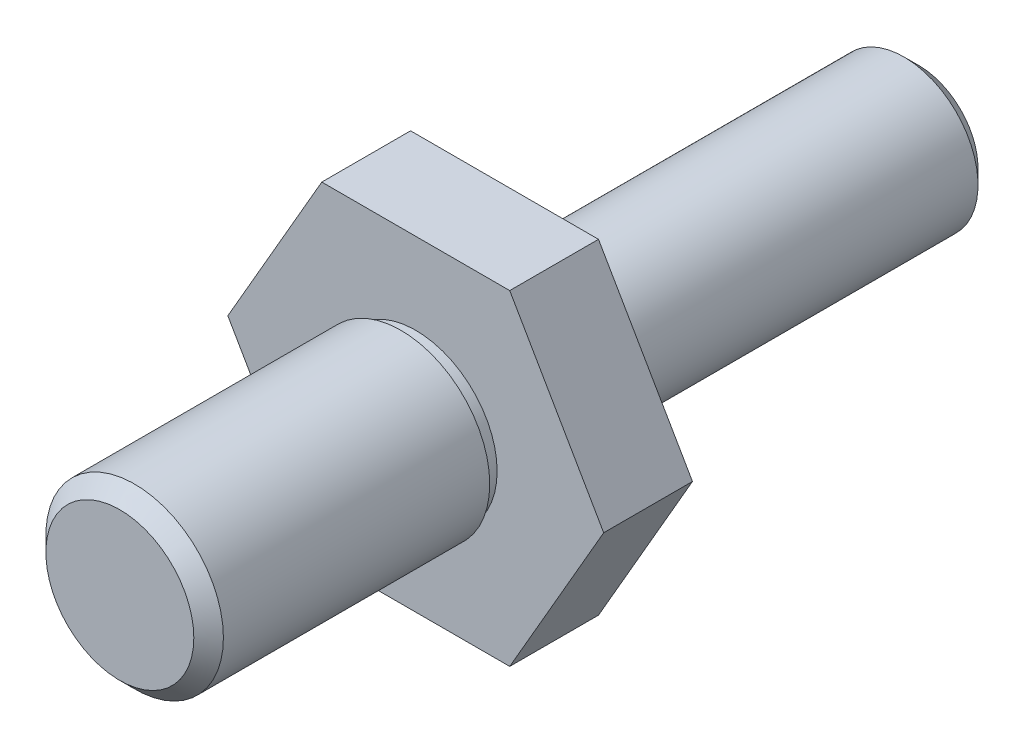
from build123d import *

# Parameters (mm, degrees)
SKETCH_1_R          = 6
EXTRUDE_1_DEPTH     = 20
EXTRUDE_2_DEPTH     = 6
SKETCH_3_R          = 7.5
EXTRUDE_3_DEPTH     = 1.5
SKETCH_4_R          = 5
EXTRUDE_4_DEPTH     = 26.5
SKETCH_6_R          = 6
SKETCH_6_R_2        = 5.5
CUT_EXTRUDE_1_DEPTH = 1
M5X0_8_1_D          = 4.2
M5X0_8_1_DEPTH      = 12.4
M5X0_8_1_TIP        = 1.2618073
CHAMFER_1_SIZE      = 1


with BuildPart() as part:
    # 草图1 → 凸台-拉伸1 (new body)
    with BuildSketch(Plane.XY):
        Circle(SKETCH_1_R)
    extrude(amount=EXTRUDE_1_DEPTH)

    # 草图2 → 凸台-拉伸2 (add)
    with BuildSketch(Plane(origin=(0, 0, 0), x_dir=(-1, 0, 0), z_dir=(0, 0, -1))):
        Polygon((6.350852961, 11), (-6.350852961, 11), (-12.701705922, 0), (-6.350852961, -11), (6.350852961, -11), (12.701705922, 0), align=None)
    extrude(amount=EXTRUDE_2_DEPTH)

    # 草图3 → 凸台-拉伸3 (add)
    with BuildSketch(Plane(origin=(0, 0, -6), x_dir=(-1, 0, 0), z_dir=(0, 0, -1))):
        Circle(SKETCH_3_R)
    extrude(amount=EXTRUDE_3_DEPTH)

    # 草图4 → 凸台-拉伸4 (add)
    with BuildSketch(Plane(origin=(0, 0, -7.5), x_dir=(-1, 0, 0), z_dir=(0, 0, -1))):
        Circle(SKETCH_4_R)
    extrude(amount=EXTRUDE_4_DEPTH)

    # 草图6 → 切除-拉伸1 (cut)
    with BuildSketch(Plane.XY):
        Circle(SKETCH_6_R)
        Circle(SKETCH_6_R_2, mode=Mode.SUBTRACT)
    extrude(amount=CUT_EXTRUDE_1_DEPTH, mode=Mode.SUBTRACT)

    # M5x0.8 螺纹孔1
    with Locations(Plane(origin=(0, 0, -34), x_dir=(-1, 0, 0), z_dir=(0, 0, -1))):
        with Locations((0, 0)):
            Hole(M5X0_8_1_D / 2, depth=M5X0_8_1_DEPTH)
            with Locations((0, 0, -(M5X0_8_1_DEPTH + M5X0_8_1_TIP / 2))):  # 118° drill point
                Cone(0, M5X0_8_1_D / 2, M5X0_8_1_TIP, mode=Mode.SUBTRACT)

    # 倒角1
    chamfer_1_edges = [part.edges().sort_by_distance(p)[0] for p in [
        (5, 0, -34),
        (-6, 0, 20),
    ]]
    chamfer(chamfer_1_edges, length=CHAMFER_1_SIZE)


solid = part.part
